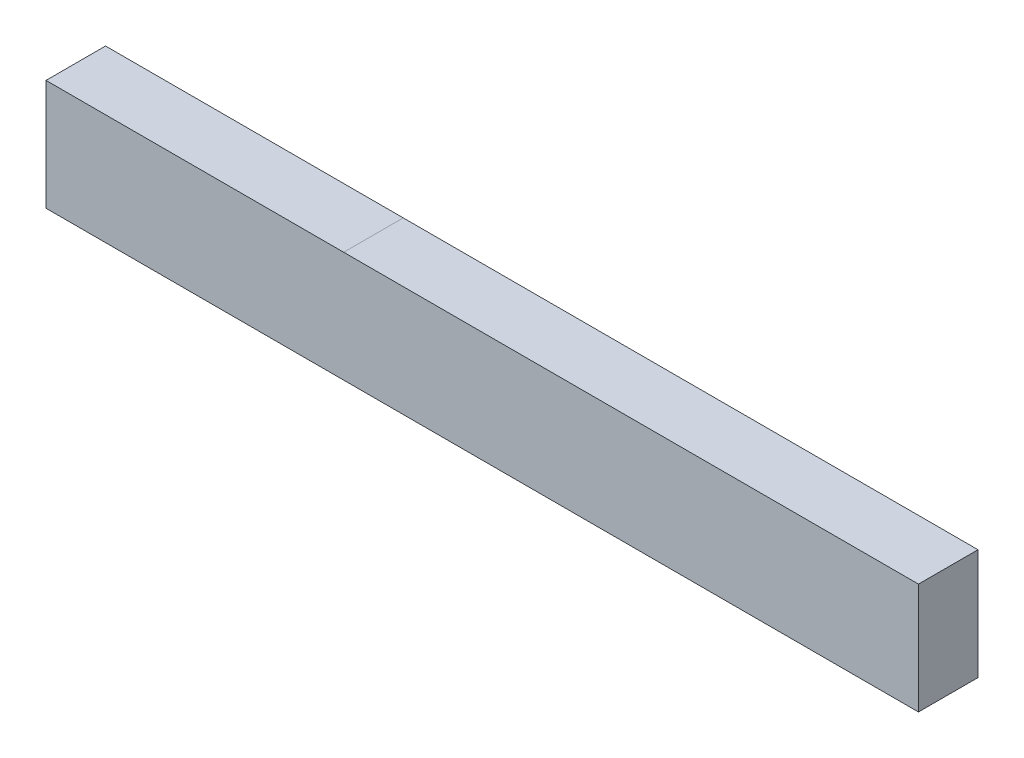
from build123d import *

# Parameters (mm, degrees)
SZKIC1_W                    = 146.534881084
SZKIC1_H                    = 18.603628118
DODANIE_WYCI_GNI_CIE1_DEPTH = 10


with BuildPart() as part:
    # Szkic1 → Dodanie-wyciągnięcie1 (new body)
    with BuildSketch(Plane.XY):
        with Locations((73.267440542, -9.301814059)):
            Rectangle(SZKIC1_W, SZKIC1_H)
    extrude(amount=DODANIE_WYCI_GNI_CIE1_DEPTH)


solid = part.part
